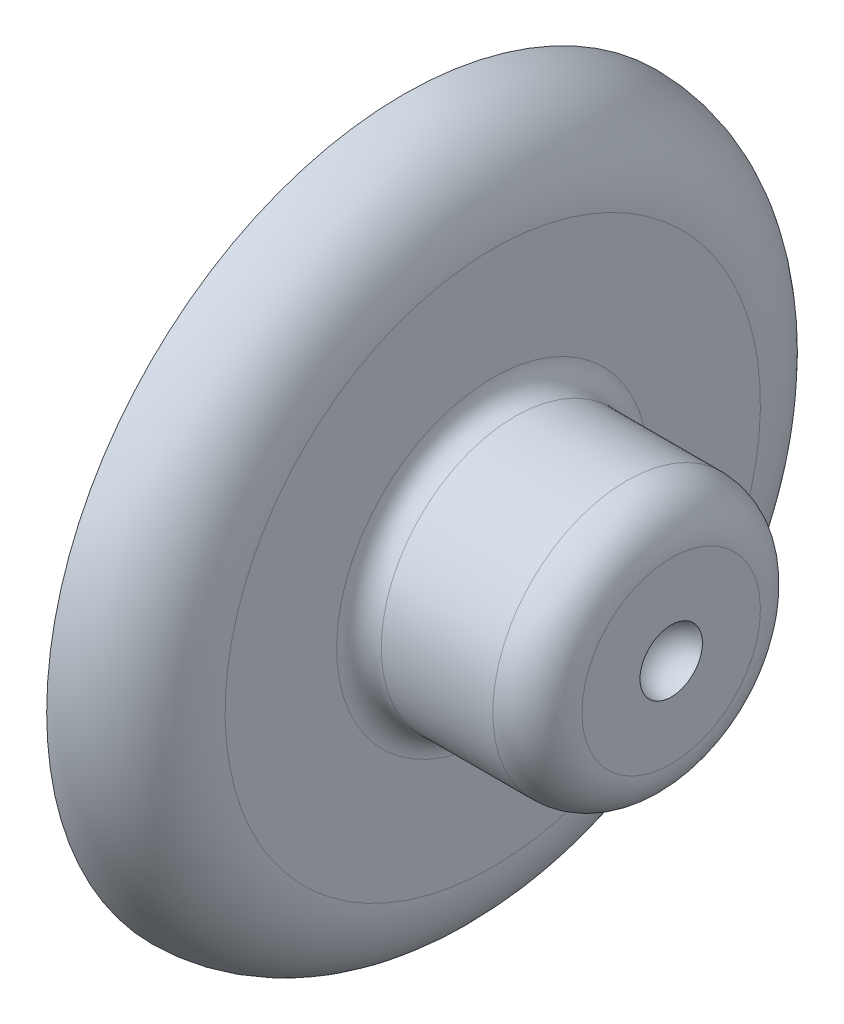
from build123d import *


with BuildPart() as part:
    # 草图1 → 旋转1 (revolve)
    with BuildSketch(Plane.XY):
        with BuildLine():
            Line((0, 0), (0, 8))
            ThreePointArc((0, 8), (1.414213562, 7.414213562), (2, 6))
            Line((2, 6), (2, 3.5))
            ThreePointArc((2, 3.5), (2.146446609, 3.146446609), (2.5, 3))
            Line((2.5, 3), (5, 3))
            ThreePointArc((5, 3), (5.707106781, 2.707106781), (6, 2))
            Line((6, 2), (6, 0.7))
            ThreePointArc((6, 0.7), (5.505025253, 0.494974747), (5.3, 0))
            Line((5.3, 0), (0, 0))
        make_face()
    revolve(axis=Axis((6, 0, 0), (-1, 0, 0)))


solid = part.part
